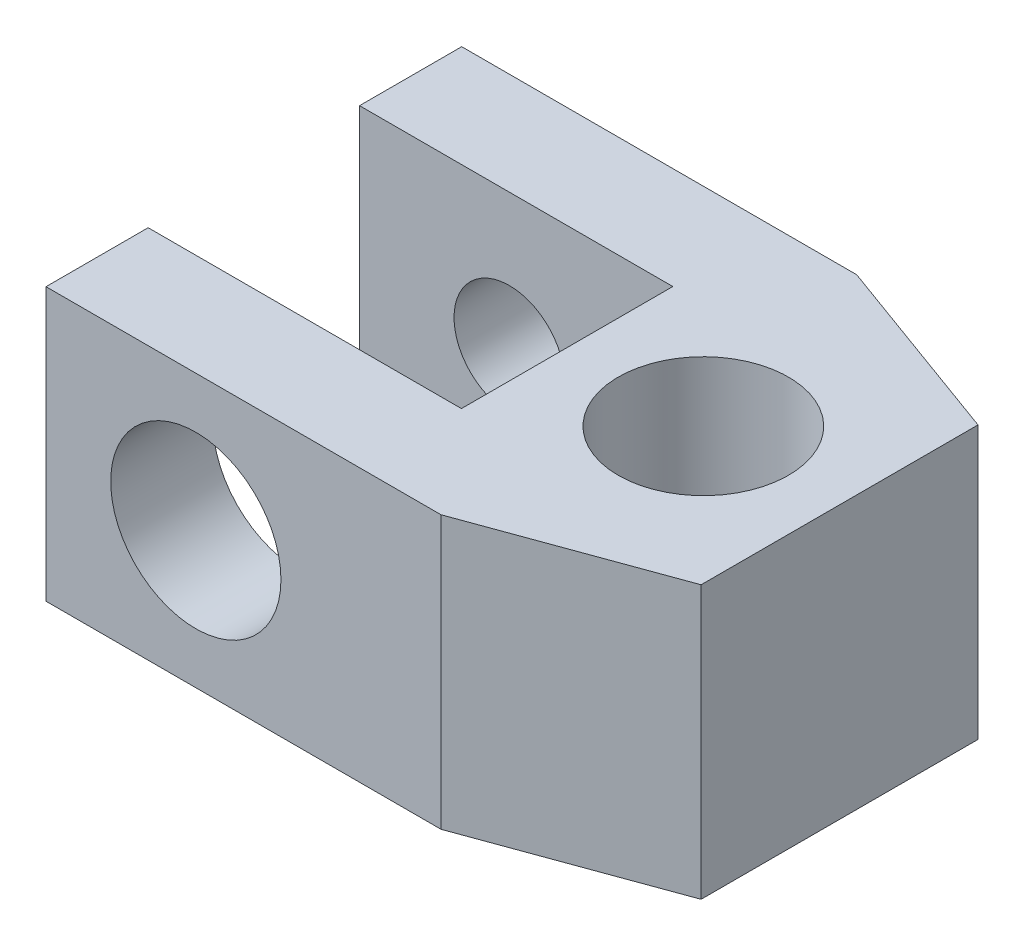
from build123d import *
from OCP.BRepFilletAPI import BRepFilletAPI_MakeChamfer

# Parameters (mm, degrees)
SKETCH1_R           = 3.96875
BOSS_EXTRUDE1_DEPTH = 12.7
SKETCH2_R           = 3.96875
CUT_EXTRUDE1_DEPTH  = 4.7625
SKETCH3_R           = 2.5796875
CUT_EXTRUDE2_DEPTH  = 34.474321177
CHAMFER1_SIZE       = 8.89
CHAMFER1_SIZE2      = 3.235695383


with BuildPart() as part:
    # Sketch1 → Boss-Extrude1 (new body)
    with BuildSketch(Plane(origin=(0, 0, 0), x_dir=(1, 0, 0), z_dir=(0, 1, 0))):
        Polygon((0, 0), (27.305, 0), (27.305, 19.3802), (0, 19.3802), (0, 14.6177), (14.605, 14.6177), (14.605, 4.7625), (0, 4.7625), align=None)
        with Locations(Location((20.955, 9.6901, 0), (0, 0, 270))):
            Circle(SKETCH1_R, mode=Mode.SUBTRACT)
    extrude(amount=BOSS_EXTRUDE1_DEPTH)

    # Sketch2 → Cut-Extrude1 (cut)
    with BuildSketch(Plane.XY):
        with Locations((6.985, 6.35)):
            Circle(SKETCH2_R)
    extrude(amount=-CUT_EXTRUDE1_DEPTH, mode=Mode.SUBTRACT)

    # Sketch3 → Cut-Extrude2 (cut, through all)
    with BuildSketch(Plane.XY.offset(-14.6177)):
        with Locations((6.985, 6.35)):
            Circle(SKETCH3_R)
    extrude(amount=-CUT_EXTRUDE2_DEPTH, mode=Mode.SUBTRACT)

    # Chamfer1: one chamfer whose edges measure the first distance from different faces: ONE call of the kernel's chamfer builder (chamfer() names one face for all edges)
    chamfer1_edges_1 = [part.edges().sort_by_distance(p)[0] for p in [
        (27.305, 6.35, -19.3802),
    ]]
    chamfer1_side_1 = [part.faces().sort_by_distance(p)[0] for p in [
        (14.080266617, 6.35, -19.3802),
    ]]
    chamfer1_edges_2 = [part.edges().sort_by_distance(p)[0] for p in [
        (27.305, 6.35, 0),
    ]]
    chamfer1_side_2 = [part.faces().sort_by_distance(p)[0] for p in [
        (14.762286847, 6.35, 0),
    ]]
    chamfer1 = BRepFilletAPI_MakeChamfer(part.part.solid().wrapped)
    for e in chamfer1_edges_1:
        chamfer1.Add(CHAMFER1_SIZE, CHAMFER1_SIZE2, e.wrapped, chamfer1_side_1[0].wrapped)  # the first distance lies on this face
    for e in chamfer1_edges_2:
        chamfer1.Add(CHAMFER1_SIZE, CHAMFER1_SIZE2, e.wrapped, chamfer1_side_2[0].wrapped)  # the first distance lies on this face
    add(Compound.cast(chamfer1.Shape()), mode=Mode.REPLACE)


solid = part.part
